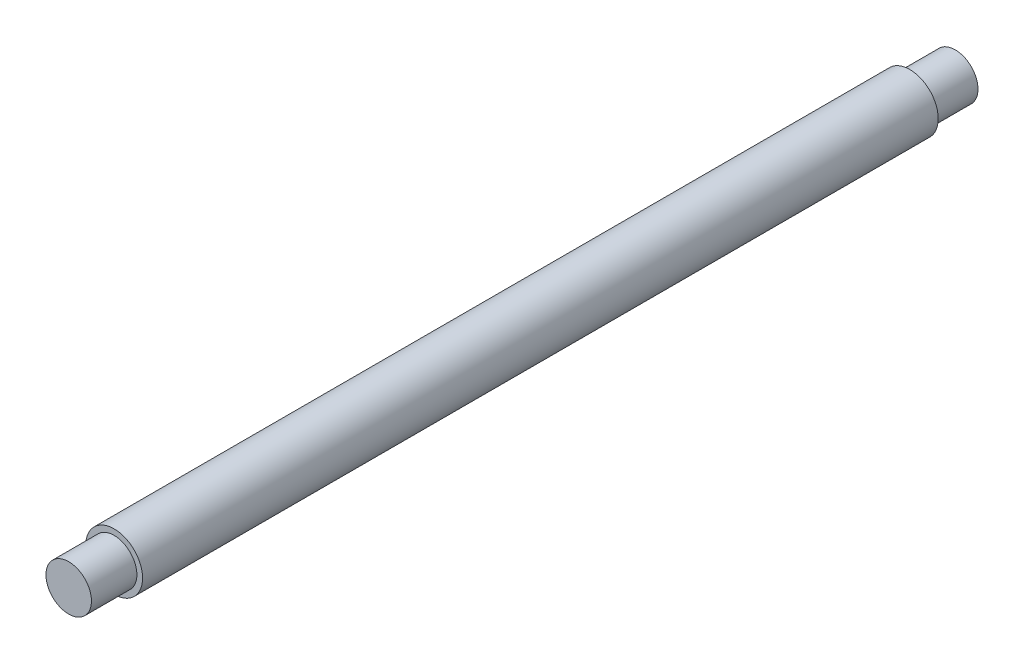
from build123d import *

# Parameters (mm, degrees)
SKETCH1_R           = 5
BOSS_EXTRUDE1_DEPTH = 70
SKETCH2_R           = 4
BOSS_EXTRUDE2_DEPTH = 8


with BuildPart() as part:
    # Sketch1 → Boss-Extrude1 (new, symmetric)
    with BuildSketch(Plane.XY):
        Circle(SKETCH1_R)
    extrude(amount=BOSS_EXTRUDE1_DEPTH, both=True)

    # Sketch2 → Boss-Extrude2 (add)
    with BuildSketch(Plane.XY.offset(70)):
        Circle(SKETCH2_R)
    boss_extrude2 = extrude(amount=BOSS_EXTRUDE2_DEPTH)

    # Mirror1: Boss-Extrude2 across plane
    add(boss_extrude2.mirror(Plane.XY))


solid = part.part
